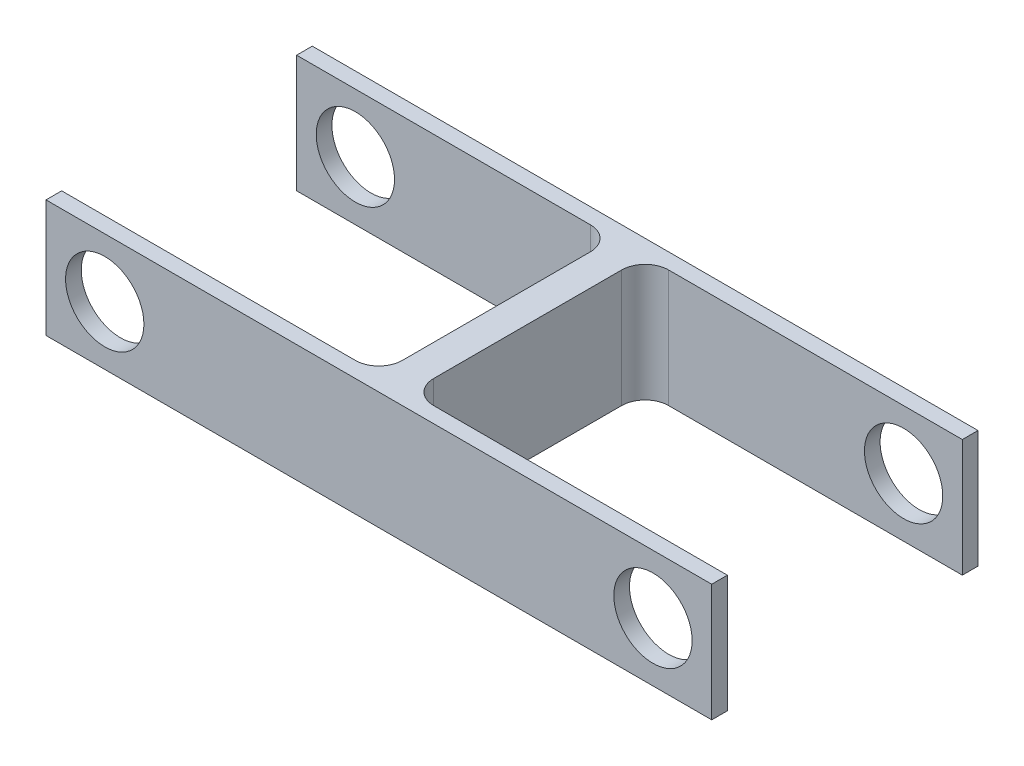
from build123d import *

# Parameters (mm, degrees)
SKETCH1_W           = 215.9
SKETCH1_H           = 38.1
BOSS_EXTRUDE1_DEPTH = 5.08
SKETCH2_R           = 12.7
CUT_EXTRUDE1_DEPTH  = 110.735643252
SKETCH3_W           = 10.16
SKETCH3_H           = 38.1
BOSS_EXTRUDE2_DEPTH = 38.1
FILLET1_R           = 7.62


with BuildPart() as part:
    # Sketch1 → Boss-Extrude1 (new body)
    with BuildSketch(Plane.XY):
        Rectangle(SKETCH1_W, SKETCH1_H)
    boss_extrude1 = extrude(amount=BOSS_EXTRUDE1_DEPTH)

    # Sketch2 → Cut-Extrude1 (cut, through all)
    with BuildSketch(Plane.XY):
        with Locations((-88.9, 0)):
            Circle(SKETCH2_R)
        with Locations((88.9, 0)):
            Circle(SKETCH2_R)
    cut_extrude1 = extrude(amount=CUT_EXTRUDE1_DEPTH, mode=Mode.SUBTRACT)

    # Sketch3 → Boss-Extrude2 (add)
    with BuildSketch(Plane.XY):
        Rectangle(SKETCH3_W, SKETCH3_H)
    boss_extrude2 = extrude(amount=-BOSS_EXTRUDE2_DEPTH)

    # Mirror2: Boss-Extrude2 across plane
    add(boss_extrude2.mirror(Plane(origin=(0, 0, -38.1), x_dir=(1, 0, 0), z_dir=(0, 0, -1))))

    # Mirror3: Boss-Extrude1, Cut-Extrude1 across plane
    add(boss_extrude1.mirror(Plane(origin=(0, 0, -38.1), x_dir=(1, 0, 0), z_dir=(0, 0, -1))))
    add(cut_extrude1.mirror(Plane(origin=(0, 0, -38.1), x_dir=(1, 0, 0), z_dir=(0, 0, -1))), mode=Mode.SUBTRACT)

    # Fillet1
    fillet1_edges = [part.edges().sort_by_distance(p)[0] for p in [
        (5.08, 0, 0),
        (-5.08, 0, 0),
        (5.08, 0, -76.2),
        (-5.08, 0, -76.2),
    ]]
    fillet(fillet1_edges, radius=FILLET1_R)


solid = part.part
